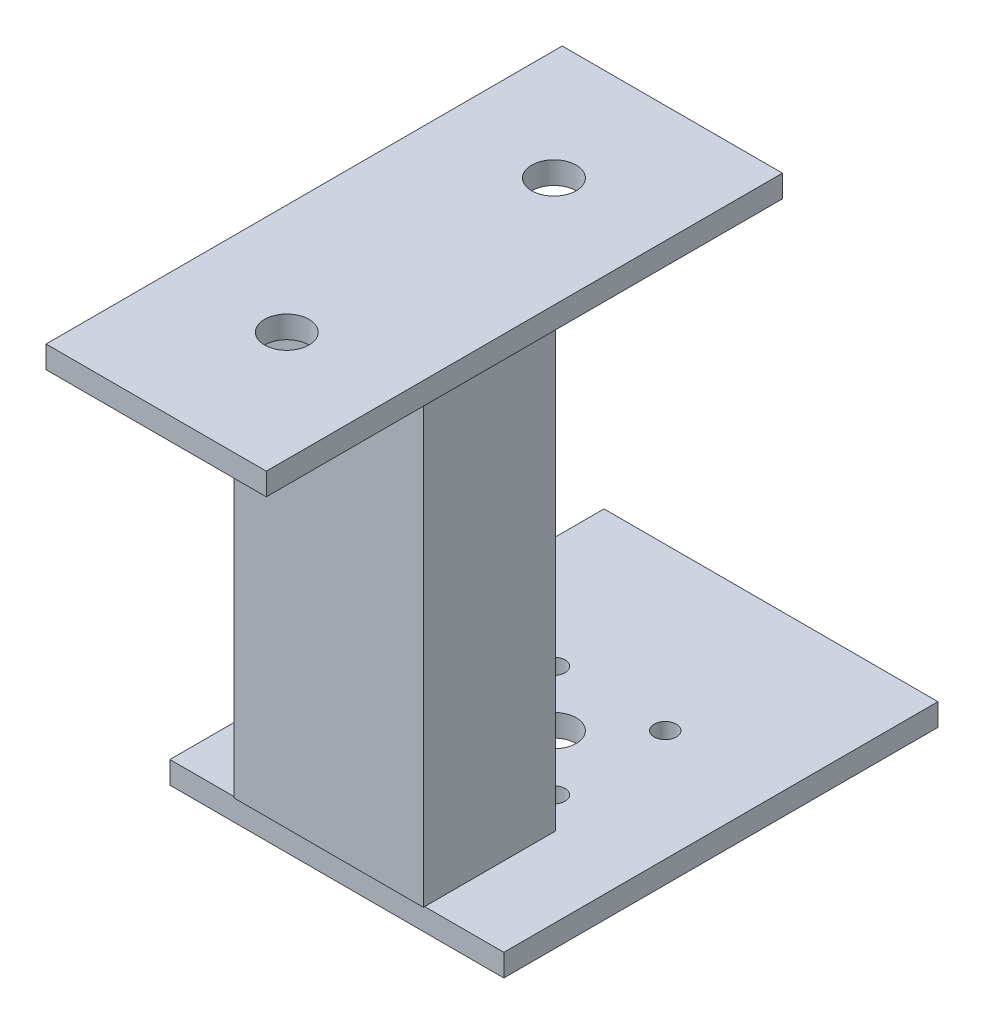
from build123d import *

# Parameters (mm, degrees)
SKETCH_1_W      = 30
SKETCH_1_H      = 39
SKETCH_1_R      = 2
SKETCH_1_R_2    = 1
EXTRUDE_1_DEPTH = 2
SKETCH_2_W      = 17.022580328
SKETCH_2_H      = 11.892604249
EXTRUDE_2_DEPTH = 43
EXTRUDE_START   = -2
SKETCH_3_W      = 19.786200008
SKETCH_3_H      = 46.373293121
SKETCH_3_R      = 2
EXTRUDE_3_DEPTH = 2


with BuildPart() as part:
    # 草图1 → 凸台-拉伸1 (new body)
    with BuildSketch(Plane(origin=(0, 0, 0), x_dir=(1, 0, 0), z_dir=(0, 1, 0))):
        with Locations((9.25, 19.5)):
            Rectangle(SKETCH_1_W, SKETCH_1_H)
        with Locations((9.25, 19.5)):
            Circle(SKETCH_1_R, mode=Mode.SUBTRACT)
        with Locations((4.25, 24.5)):
            Circle(SKETCH_1_R_2, mode=Mode.SUBTRACT)
        with Locations((14.25, 24.5)):
            Circle(SKETCH_1_R_2, mode=Mode.SUBTRACT)
        with Locations((4.25, 14.5)):
            Circle(SKETCH_1_R_2, mode=Mode.SUBTRACT)
        with Locations((14.25, 14.5)):
            Circle(SKETCH_1_R_2, mode=Mode.SUBTRACT)
    extrude(amount=EXTRUDE_1_DEPTH)

    # 草图2 → 凸台-拉伸2 (add)
    with BuildSketch(Plane(origin=(0, 2, 0), x_dir=(1, 0, 0), z_dir=(0, 1, 0))):
        with Locations((8.624620537, 5.830652978)):
            Rectangle(SKETCH_2_W, SKETCH_2_H)
    extrude(amount=EXTRUDE_2_DEPTH)

    # 草图3 → 凸台-拉伸3 (add)
    with BuildSketch(Plane(origin=(0, 45, 0), x_dir=(1, 0, 0), z_dir=(0, 1, 0)).offset(EXTRUDE_START)):
        with Locations((9.25, 6.951413881)):
            Rectangle(SKETCH_3_W, SKETCH_3_H)
        with Locations((9.25, -4.5)):
            Circle(SKETCH_3_R, mode=Mode.SUBTRACT)
        with BuildLine():
            ThreePointArc((9.25, 21.5), (10.664213562, 20.914213562), (11.25, 19.5))
            ThreePointArc((11.25, 19.5), (7.835786438, 18.085786438), (9.25, 21.5))
        make_face(mode=Mode.SUBTRACT)
    extrude(amount=EXTRUDE_3_DEPTH)


solid = part.part
